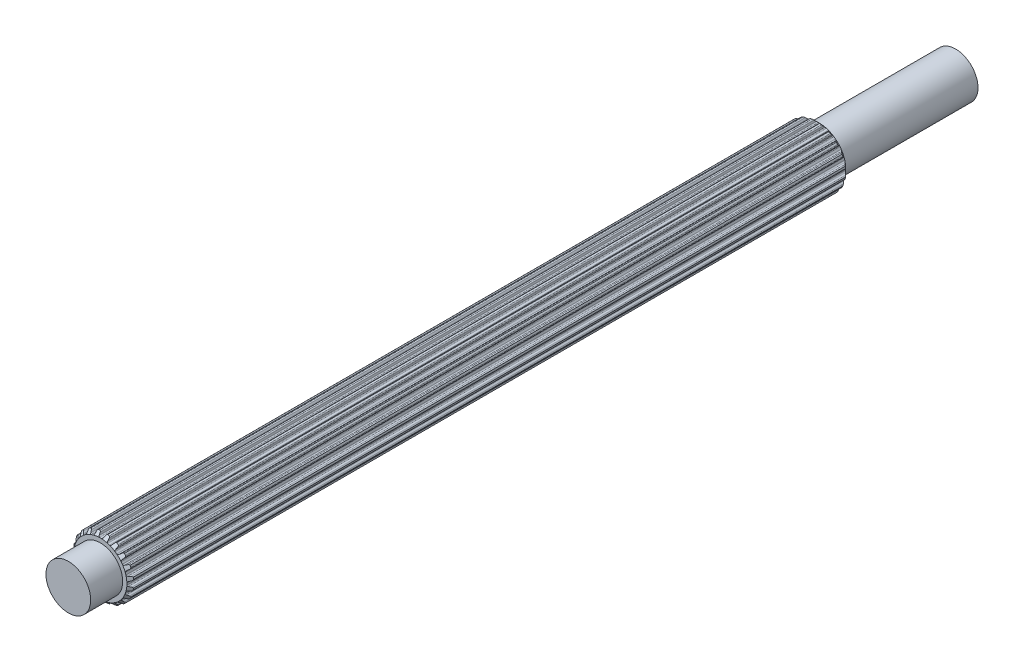
from build123d import *

# Parameters (mm, degrees)
BOSS_EXTRUDE1_DEPTH      = 46.04766
BOSS_EXTRUDE1_DEPTH_BACK = 34.36366
SKETCH2_R                = 2.5019
BOSS_EXTRUDE2_DEPTH      = 49.62906


with BuildPart() as part:
    # Sketch1 → Boss-Extrude1 (new, two sides: drawn at the far end of the back side and taken through both)
    with BuildSketch(Plane.XY.offset(-BOSS_EXTRUDE1_DEPTH_BACK)):
        with BuildLine():
            Line((-0.106949245, 2.969874934), (0.106949245, 2.969874934))
            ThreePointArc((0.106949245, 2.969874934), (0.196343213, 2.986924176), (0.253739238, 3.057547504))
            Line((0.253739238, 3.057547504), (0.315888147, 3.237526941))
            ThreePointArc((0.315888147, 3.237526941), (0.359032156, 3.298322911), (0.4281449, 3.326269005))
            Line((0.4281449, 3.326269005), (0.620027588, 3.2937547))
            ThreePointArc((0.620027588, 3.2937547), (0.689621142, 3.24802576), (0.718272212, 3.169836791))
            Line((0.718272212, 3.169836791), (0.724389167, 2.979527391))
            ThreePointArc((0.724389167, 2.979527391), (0.750934762, 2.9040661), (0.816027049, 2.857568043))
            Line((0.816027049, 2.857568043), (1.019456602, 2.791469774))
            ThreePointArc((1.019456602, 2.791469774), (1.109743823, 2.780060312), (1.186154496, 2.829490741))
            Line((1.186154496, 2.829490741), (1.300878326, 2.981456288))
            ThreePointArc((1.300878326, 2.981456288), (1.360697704, 3.02594446), (1.435063648, 3.031165762))
            Line((1.435063648, 3.031165762), (1.607507455, 2.940947809))
            ThreePointArc((1.607507455, 2.940947809), (1.659563839, 2.875951412), (1.662650905, 2.792735615))
            Line((1.662650905, 2.792735615), (1.609659636, 2.609850378))
            ThreePointArc((1.609659636, 2.609850378), (1.611587176, 2.529879385), (1.659124931, 2.465542482))
            Line((1.659124931, 2.465542482), (1.832172444, 2.339816104))
            ThreePointArc((1.832172444, 2.339816104), (1.914514976, 2.301064775), (2.002460687, 2.32446371))
            Line((2.002460687, 2.32446371), (2.158529469, 2.433539921))
            ThreePointArc((2.158529469, 2.433539921), (2.229168681, 2.457365482), (2.301508367, 2.439350895))
            Line((2.301508367, 2.439350895), (2.437633293, 2.300260456))
            ThreePointArc((2.437633293, 2.300260456), (2.467056864, 2.222358901), (2.444277744, 2.14226202))
            Line((2.444277744, 2.14226202), (2.337365406, 1.984703026))
            ThreePointArc((2.337365406, 1.984703026), (2.314486209, 1.908050449), (2.339816104, 1.832172444))
            Line((2.339816104, 1.832172444), (2.465542482, 1.659124931))
            ThreePointArc((2.465542482, 1.659124931), (2.531880064, 1.596824985), (2.622752074, 1.591901975))
            Line((2.622752074, 1.591901975), (2.804888709, 1.64741171))
            ThreePointArc((2.804888709, 1.64741171), (2.879433095, 1.648242449), (2.942665411, 1.608755366))
            Line((2.942665411, 1.608755366), (3.0291466, 1.434407582))
            ThreePointArc((3.0291466, 1.434407582), (3.033057175, 1.351226417), (2.986641646, 1.282088892))
            Line((2.986641646, 1.282088892), (2.836273564, 1.165279113))
            ThreePointArc((2.836273564, 1.165279113), (2.790827206, 1.099448241), (2.791469774, 1.019456602))
            Line((2.791469774, 1.019456602), (2.857568043, 0.816027049))
            ThreePointArc((2.857568043, 0.816027049), (2.901407091, 0.736276839), (2.986310214, 0.703513784))
            Line((2.986310214, 0.703513784), (3.1766859, 0.700023363))
            ThreePointArc((3.1766859, 0.700023363), (3.247838536, 0.677777961), (3.295773863, 0.620683653))
            Line((3.295773863, 0.620683653), (3.324145932, 0.4281449))
            ThreePointArc((3.324145932, 0.4281449), (3.302160717, 0.347826477), (3.236652255, 0.29641597))
            Line((3.236652255, 0.29641597), (3.057547504, 0.231789562))
            ThreePointArc((3.057547504, 0.231789562), (2.993982591, 0.183224379), (2.969874934, 0.106949245))
            Line((2.969874934, 0.106949245), (2.969874934, -0.106949245))
            ThreePointArc((2.969874934, -0.106949245), (2.986924176, -0.196343213), (3.057547504, -0.253739238))
            Line((3.057547504, -0.253739238), (3.237526941, -0.315888147))
            ThreePointArc((3.237526941, -0.315888147), (3.298322911, -0.359032156), (3.326269005, -0.4281449))
            Line((3.326269005, -0.4281449), (3.2937547, -0.620027588))
            ThreePointArc((3.2937547, -0.620027588), (3.24802576, -0.689621142), (3.169836791, -0.718272212))
            Line((3.169836791, -0.718272212), (2.979527391, -0.724389167))
            ThreePointArc((2.979527391, -0.724389167), (2.9040661, -0.750934762), (2.857568043, -0.816027049))
            Line((2.857568043, -0.816027049), (2.791469774, -1.019456602))
            ThreePointArc((2.791469774, -1.019456602), (2.780060312, -1.109743823), (2.829490741, -1.186154496))
            Line((2.829490741, -1.186154496), (2.981456288, -1.300878326))
            ThreePointArc((2.981456288, -1.300878326), (3.02594446, -1.360697704), (3.031165762, -1.435063648))
            Line((3.031165762, -1.435063648), (2.940947809, -1.607507455))
            ThreePointArc((2.940947809, -1.607507455), (2.875951412, -1.659563839), (2.792735615, -1.662650905))
            Line((2.792735615, -1.662650905), (2.609850378, -1.609659636))
            ThreePointArc((2.609850378, -1.609659636), (2.529879385, -1.611587176), (2.465542482, -1.659124931))
            Line((2.465542482, -1.659124931), (2.339816104, -1.832172444))
            ThreePointArc((2.339816104, -1.832172444), (2.301064775, -1.914514976), (2.32446371, -2.002460687))
            Line((2.32446371, -2.002460687), (2.433539921, -2.158529469))
            ThreePointArc((2.433539921, -2.158529469), (2.457365482, -2.229168681), (2.439350895, -2.301508367))
            Line((2.439350895, -2.301508367), (2.300260456, -2.437633293))
            ThreePointArc((2.300260456, -2.437633293), (2.222358901, -2.467056864), (2.14226202, -2.444277744))
            Line((2.14226202, -2.444277744), (1.984703026, -2.337365406))
            ThreePointArc((1.984703026, -2.337365406), (1.908050449, -2.314486209), (1.832172444, -2.339816104))
            Line((1.832172444, -2.339816104), (1.659124931, -2.465542482))
            ThreePointArc((1.659124931, -2.465542482), (1.596824985, -2.531880064), (1.591901975, -2.622752074))
            Line((1.591901975, -2.622752074), (1.64741171, -2.804888709))
            ThreePointArc((1.64741171, -2.804888709), (1.648242449, -2.879433095), (1.608755366, -2.942665411))
            Line((1.608755366, -2.942665411), (1.434407582, -3.0291466))
            ThreePointArc((1.434407582, -3.0291466), (1.351226417, -3.033057175), (1.282088892, -2.986641646))
            Line((1.282088892, -2.986641646), (1.165279113, -2.836273564))
            ThreePointArc((1.165279113, -2.836273564), (1.099448241, -2.790827206), (1.019456602, -2.791469774))
            Line((1.019456602, -2.791469774), (0.816027049, -2.857568043))
            ThreePointArc((0.816027049, -2.857568043), (0.736276839, -2.901407091), (0.703513784, -2.986310214))
            Line((0.703513784, -2.986310214), (0.700023363, -3.1766859))
            ThreePointArc((0.700023363, -3.1766859), (0.677777961, -3.247838536), (0.620683653, -3.295773863))
            Line((0.620683653, -3.295773863), (0.4281449, -3.324145932))
            ThreePointArc((0.4281449, -3.324145932), (0.347826477, -3.302160717), (0.29641597, -3.236652255))
            Line((0.29641597, -3.236652255), (0.231789562, -3.057547504))
            ThreePointArc((0.231789562, -3.057547504), (0.183224379, -2.993982591), (0.106949245, -2.969874934))
            Line((0.106949245, -2.969874934), (-0.106949245, -2.969874934))
            ThreePointArc((-0.106949245, -2.969874934), (-0.196343213, -2.986924176), (-0.253739238, -3.057547504))
            Line((-0.253739238, -3.057547504), (-0.315888147, -3.237526941))
            ThreePointArc((-0.315888147, -3.237526941), (-0.359032156, -3.298322911), (-0.4281449, -3.326269005))
            Line((-0.4281449, -3.326269005), (-0.620027588, -3.2937547))
            ThreePointArc((-0.620027588, -3.2937547), (-0.689621142, -3.24802576), (-0.718272212, -3.169836791))
            Line((-0.718272212, -3.169836791), (-0.724389167, -2.979527391))
            ThreePointArc((-0.724389167, -2.979527391), (-0.750934762, -2.9040661), (-0.816027049, -2.857568043))
            Line((-0.816027049, -2.857568043), (-1.019456602, -2.791469774))
            ThreePointArc((-1.019456602, -2.791469774), (-1.109743823, -2.780060312), (-1.186154496, -2.829490741))
            Line((-1.186154496, -2.829490741), (-1.300878326, -2.981456288))
            ThreePointArc((-1.300878326, -2.981456288), (-1.360697704, -3.02594446), (-1.435063648, -3.031165762))
            Line((-1.435063648, -3.031165762), (-1.607507455, -2.940947809))
            ThreePointArc((-1.607507455, -2.940947809), (-1.659563839, -2.875951412), (-1.662650905, -2.792735615))
            Line((-1.662650905, -2.792735615), (-1.609659636, -2.609850378))
            ThreePointArc((-1.609659636, -2.609850378), (-1.611587176, -2.529879385), (-1.659124931, -2.465542482))
            Line((-1.659124931, -2.465542482), (-1.832172444, -2.339816104))
            ThreePointArc((-1.832172444, -2.339816104), (-1.914514976, -2.301064775), (-2.002460687, -2.32446371))
            Line((-2.002460687, -2.32446371), (-2.158529469, -2.433539921))
            ThreePointArc((-2.158529469, -2.433539921), (-2.229168681, -2.457365482), (-2.301508367, -2.439350895))
            Line((-2.301508367, -2.439350895), (-2.437633293, -2.300260456))
            ThreePointArc((-2.437633293, -2.300260456), (-2.467056864, -2.222358901), (-2.444277744, -2.14226202))
            Line((-2.444277744, -2.14226202), (-2.337365406, -1.984703026))
            ThreePointArc((-2.337365406, -1.984703026), (-2.314486209, -1.908050449), (-2.339816104, -1.832172444))
            Line((-2.339816104, -1.832172444), (-2.465542482, -1.659124931))
            ThreePointArc((-2.465542482, -1.659124931), (-2.531880064, -1.596824985), (-2.622752074, -1.591901975))
            Line((-2.622752074, -1.591901975), (-2.804888709, -1.64741171))
            ThreePointArc((-2.804888709, -1.64741171), (-2.879433095, -1.648242449), (-2.942665411, -1.608755366))
            Line((-2.942665411, -1.608755366), (-3.0291466, -1.434407582))
            ThreePointArc((-3.0291466, -1.434407582), (-3.033057175, -1.351226417), (-2.986641646, -1.282088892))
            Line((-2.986641646, -1.282088892), (-2.836273564, -1.165279113))
            ThreePointArc((-2.836273564, -1.165279113), (-2.790827206, -1.099448241), (-2.791469774, -1.019456602))
            Line((-2.791469774, -1.019456602), (-2.857568043, -0.816027049))
            ThreePointArc((-2.857568043, -0.816027049), (-2.901407091, -0.736276839), (-2.986310214, -0.703513784))
            Line((-2.986310214, -0.703513784), (-3.1766859, -0.700023363))
            ThreePointArc((-3.1766859, -0.700023363), (-3.247838536, -0.677777961), (-3.295773863, -0.620683653))
            Line((-3.295773863, -0.620683653), (-3.324145932, -0.4281449))
            ThreePointArc((-3.324145932, -0.4281449), (-3.302160717, -0.347826477), (-3.236652255, -0.29641597))
            Line((-3.236652255, -0.29641597), (-3.057547504, -0.231789562))
            ThreePointArc((-3.057547504, -0.231789562), (-2.993982591, -0.183224379), (-2.969874934, -0.106949245))
            Line((-2.969874934, -0.106949245), (-2.969874934, 0.106949245))
            ThreePointArc((-2.969874934, 0.106949245), (-2.986924176, 0.196343213), (-3.057547504, 0.253739238))
            Line((-3.057547504, 0.253739238), (-3.237526941, 0.315888147))
            ThreePointArc((-3.237526941, 0.315888147), (-3.298322911, 0.359032156), (-3.326269005, 0.4281449))
            Line((-3.326269005, 0.4281449), (-3.2937547, 0.620027588))
            ThreePointArc((-3.2937547, 0.620027588), (-3.24802576, 0.689621142), (-3.169836791, 0.718272212))
            Line((-3.169836791, 0.718272212), (-2.979527391, 0.724389167))
            ThreePointArc((-2.979527391, 0.724389167), (-2.9040661, 0.750934762), (-2.857568043, 0.816027049))
            Line((-2.857568043, 0.816027049), (-2.791469774, 1.019456602))
            ThreePointArc((-2.791469774, 1.019456602), (-2.780060312, 1.109743823), (-2.829490741, 1.186154496))
            Line((-2.829490741, 1.186154496), (-2.981456288, 1.300878326))
            ThreePointArc((-2.981456288, 1.300878326), (-3.02594446, 1.360697704), (-3.031165762, 1.435063648))
            Line((-3.031165762, 1.435063648), (-2.940947809, 1.607507455))
            ThreePointArc((-2.940947809, 1.607507455), (-2.875951412, 1.659563839), (-2.792735615, 1.662650905))
            Line((-2.792735615, 1.662650905), (-2.609850378, 1.609659636))
            ThreePointArc((-2.609850378, 1.609659636), (-2.529879385, 1.611587176), (-2.465542482, 1.659124931))
            Line((-2.465542482, 1.659124931), (-2.339816104, 1.832172444))
            ThreePointArc((-2.339816104, 1.832172444), (-2.301064775, 1.914514976), (-2.32446371, 2.002460687))
            Line((-2.32446371, 2.002460687), (-2.433539921, 2.158529469))
            ThreePointArc((-2.433539921, 2.158529469), (-2.457365482, 2.229168681), (-2.439350895, 2.301508367))
            Line((-2.439350895, 2.301508367), (-2.300260456, 2.437633293))
            ThreePointArc((-2.300260456, 2.437633293), (-2.222358901, 2.467056864), (-2.14226202, 2.444277744))
            Line((-2.14226202, 2.444277744), (-1.984703026, 2.337365406))
            ThreePointArc((-1.984703026, 2.337365406), (-1.908050449, 2.314486209), (-1.832172444, 2.339816104))
            Line((-1.832172444, 2.339816104), (-1.659124931, 2.465542482))
            ThreePointArc((-1.659124931, 2.465542482), (-1.596824985, 2.531880064), (-1.591901975, 2.622752074))
            Line((-1.591901975, 2.622752074), (-1.64741171, 2.804888709))
            ThreePointArc((-1.64741171, 2.804888709), (-1.648242449, 2.879433095), (-1.608755366, 2.942665411))
            Line((-1.608755366, 2.942665411), (-1.434407582, 3.0291466))
            ThreePointArc((-1.434407582, 3.0291466), (-1.351226417, 3.033057175), (-1.282088892, 2.986641646))
            Line((-1.282088892, 2.986641646), (-1.165279113, 2.836273564))
            ThreePointArc((-1.165279113, 2.836273564), (-1.099448241, 2.790827206), (-1.019456602, 2.791469774))
            Line((-1.019456602, 2.791469774), (-0.816027049, 2.857568043))
            ThreePointArc((-0.816027049, 2.857568043), (-0.736276839, 2.901407091), (-0.703513784, 2.986310214))
            Line((-0.703513784, 2.986310214), (-0.700023363, 3.1766859))
            ThreePointArc((-0.700023363, 3.1766859), (-0.677777961, 3.247838536), (-0.620683653, 3.295773863))
            Line((-0.620683653, 3.295773863), (-0.4281449, 3.324145932))
            ThreePointArc((-0.4281449, 3.324145932), (-0.347826477, 3.302160717), (-0.29641597, 3.236652255))
            Line((-0.29641597, 3.236652255), (-0.231789562, 3.057547504))
            ThreePointArc((-0.231789562, 3.057547504), (-0.183224379, 2.993982591), (-0.106949245, 2.969874934))
        make_face()
    extrude(amount=BOSS_EXTRUDE1_DEPTH + BOSS_EXTRUDE1_DEPTH_BACK)

    # Sketch2 → Boss-Extrude2 (add, symmetric)
    with BuildSketch(Plane.XY):
        Circle(SKETCH2_R)
    extrude(amount=BOSS_EXTRUDE2_DEPTH, both=True)

    # Sketch3 → Cut-Revolve1 (revolve, cut)
    with BuildSketch(Plane(origin=(0, 0, 0), x_dir=(0, 0, -1), z_dir=(1, 0, 0))):
        Polygon((-44.916435505, 4.101099429), (-46.04766, 2.969874934), (-46.04766, 4.101099429), align=None)
        Polygon((34.36366, 31.077529155), (34.36366, 2.969874934), (20.309832889, 17.023702045), align=None)
    revolve(axis=Axis((0, 0, 14.360793934), (0, 0, -1)), mode=Mode.SUBTRACT)


solid = part.part
